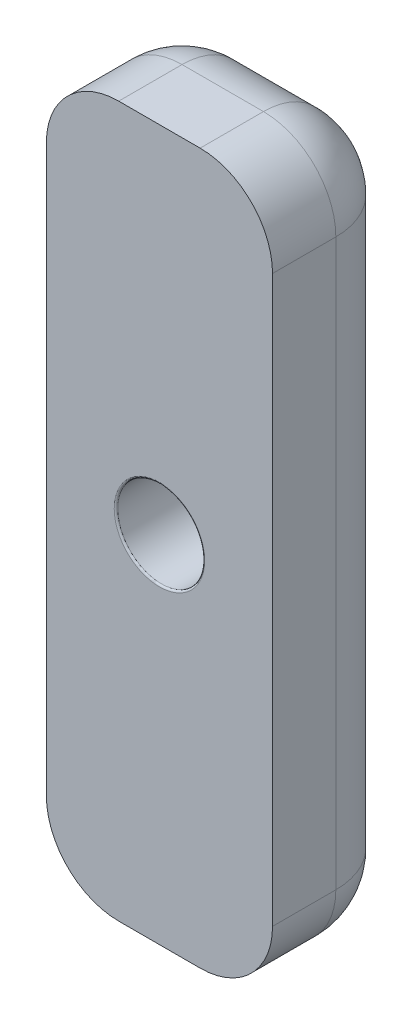
from build123d import *

# Parameters (mm, degrees)
SKETCH1_W           = 78.5
SKETCH1_H           = 25
BOSS_EXTRUDE1_DEPTH = 15
SKETCH2_R           = 4.8
CUT_EXTRUDE1_DEPTH  = 13
FILLET1_R           = 0.2
FILLET2_R           = 8
FILLET3_R           = 8


with BuildPart() as part:
    # Sketch1 → Boss-Extrude1 (new body)
    with BuildSketch(Plane(origin=(0, 0, 0), x_dir=(0, 1, 0), z_dir=(0, 0, 1))):
        Rectangle(SKETCH1_W, SKETCH1_H)
    extrude(amount=BOSS_EXTRUDE1_DEPTH)

    # Sketch2 → Cut-Extrude1 (cut)
    with BuildSketch(Plane.XY.offset(15)):
        Circle(SKETCH2_R)
    extrude(amount=-CUT_EXTRUDE1_DEPTH, mode=Mode.SUBTRACT)

    # Fillet1
    fillet1_edges = [part.edges().sort_by_distance(p)[0] for p in [
        (-4.8, 0, 15),
    ]]
    fillet(fillet1_edges, radius=FILLET1_R)

    # Fillet2
    fillet2_edges = [part.edges().sort_by_distance(p)[0] for p in [
        (12.5, 39.25, 7.5),
        (12.5, -39.25, 7.5),
        (-12.5, -39.25, 7.5),
        (-12.5, 39.25, 7.5),
    ]]
    fillet(fillet2_edges, radius=FILLET2_R)

    # Fillet3
    fillet3_edges = [part.edges().sort_by_distance(p)[0] for p in [
        (0, -39.25, 0),
        (0, 39.25, 0),
        (12.5, 0, 0),
        (-12.5, 0, 0),
        (-10.156854249, 36.906854249, 0),
        (10.156854249, 36.906854249, 0),
        (10.156854249, -36.906854249, 0),
        (-10.156854249, -36.906854249, 0),
    ]]
    fillet(fillet3_edges, radius=FILLET3_R)


solid = part.part
